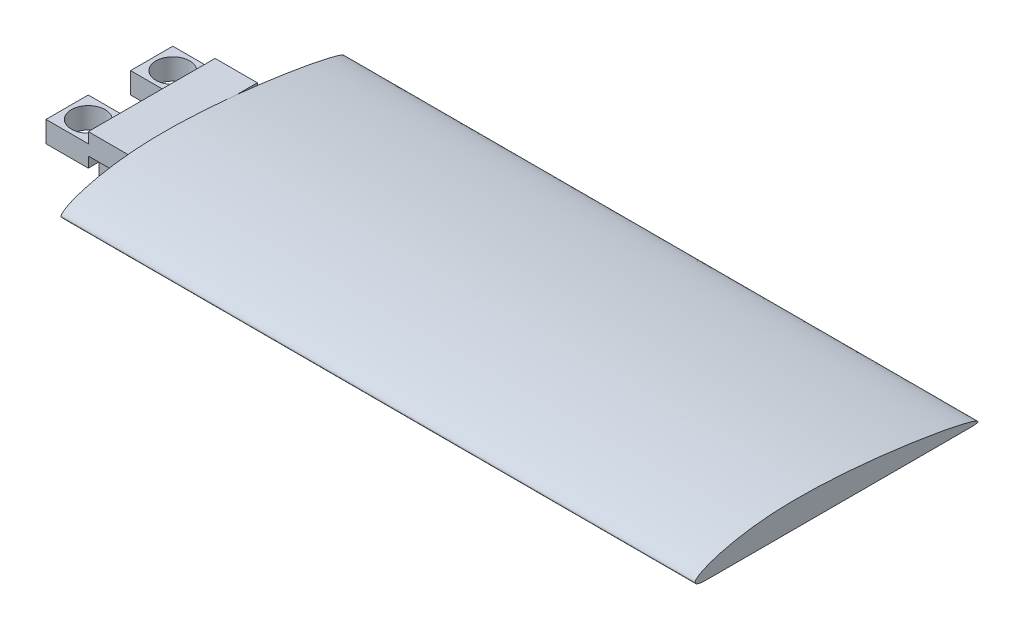
from build123d import *

# Parameters (mm, degrees)
SKETCH1_W             = 10
SKETCH1_H             = 10
SKETCH1_R             = 4
BOSS_EXTRUDE1_DEPTH   = 5
BOSS_EXTRUDE1_2_DEPTH = 5
SKETCH2_W             = 5
SKETCH2_H             = 10
BOSS_EXTRUDE2_DEPTH   = 5
SKETCH4_W             = 10
SKETCH4_H             = 30
BOSS_EXTRUDE4_DEPTH   = 2.5
BOSS_EXTRUDE6_DEPTH   = 150


with BuildPart() as part:
    # Sketch1 → Boss-Extrude1 (new body)
    with BuildSketch(Plane(origin=(0, 0, 0), x_dir=(1, 0, 0), z_dir=(0, 1, 0))):
        with Locations((5, 0)):
            Rectangle(SKETCH1_W, SKETCH1_H)
        with Locations(Location((5, 0, 0), (0, 0, 270))):
            Circle(SKETCH1_R, mode=Mode.SUBTRACT)
    extrude(amount=BOSS_EXTRUDE1_DEPTH)

    # Sketch2 → Boss-Extrude2 (add)
    with BuildSketch(Plane(origin=(10, 0, 0), x_dir=(0, 0, -1), z_dir=(1, 0, 0))):
        Rectangle(SKETCH2_W, SKETCH2_H)
        with Locations((20, 0)):
            Rectangle(SKETCH2_W, SKETCH2_H)
    extrude(amount=BOSS_EXTRUDE2_DEPTH)


with BuildPart() as body_2:
    # Sketch1 → Boss-Extrude1 2 (new body)
    with BuildSketch(Plane(origin=(0, 0, 0), x_dir=(1, 0, 0), z_dir=(0, 1, 0))):
        with Locations((5, 20)):
            Rectangle(SKETCH1_W, SKETCH1_H)
        with Locations(Location((5, 20, 0), (0, 0, 90))):
            Circle(SKETCH1_R, mode=Mode.SUBTRACT)
    extrude(amount=BOSS_EXTRUDE1_2_DEPTH)


with BuildPart() as boss_extrude2_piece_1:
    # of the separate pieces the step leaves, piece 1, a body of its own (boss_extrude2_pieces)
    add(part.part.solids().sort_by_distance((0, 0, -5))[0])

    # Sketch4 → Boss-Extrude4 (add, symmetric)
    with BuildSketch(Plane(origin=(0, 5, 0), x_dir=(1, 0, 0), z_dir=(0, 1, 0))):
        with Locations((15, 10)):
            Rectangle(SKETCH4_W, SKETCH4_H)
    extrude(amount=BOSS_EXTRUDE4_DEPTH, both=True)

    # Sketch6 → Boss-Extrude6 (add)
    with BuildSketch(Plane(origin=(20, 0, 0), x_dir=(0, 0, -1), z_dir=(1, 0, 0))):
        with BuildLine():
            Line((-18.53898382, 2.5), (43.581863342, 2.5))
            add(Edge.make_bspline(
                [(-18.53898382, 2.5), (-26.228737323, 2.5), (-5.8215462, 14.53776726), (54.109415672, 2.5), (43.581863342, 2.5)],
                knots=[0, 0, 0, 0, 0.416526346, 1, 1, 1, 1], degree=3))
        make_face()
    extrude(amount=BOSS_EXTRUDE6_DEPTH)


with BuildPart() as boss_extrude2_piece_2:
    # of the separate pieces the step leaves, piece 2, a body of its own (boss_extrude2_pieces)
    add(part.part.solids().sort_by_distance((10, -5, -17.5))[0])


solid = Compound([body_2.part, boss_extrude2_piece_1.part, boss_extrude2_piece_2.part])
